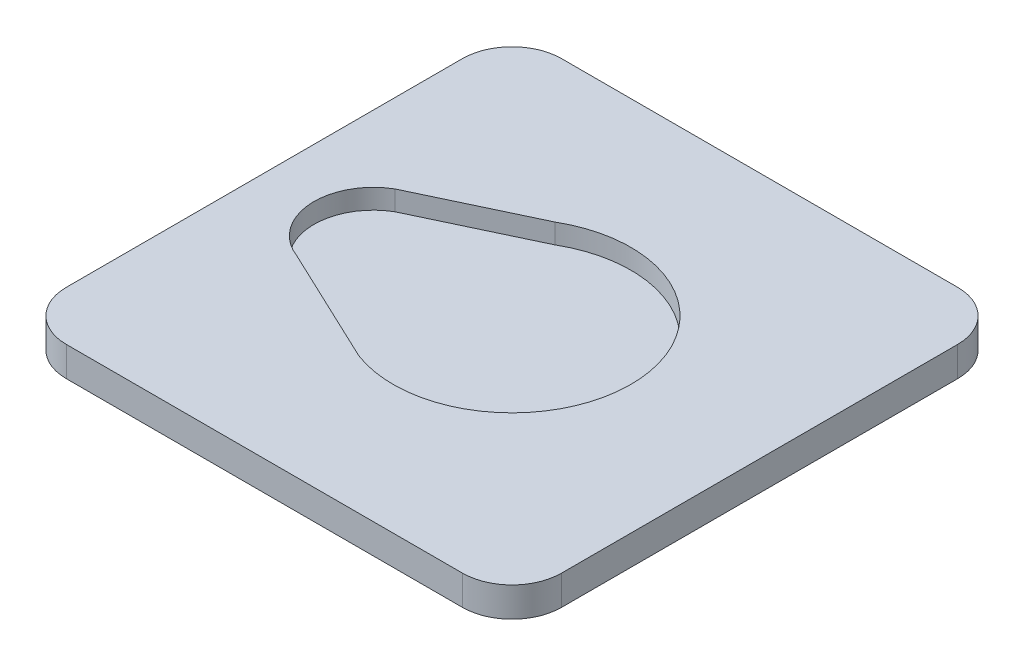
from build123d import *

# Parameters (mm, degrees)
BOSS_EXTRUDE1_DEPTH = 15
BOSS_EXTRUDE2_DEPTH = 5
SKETCH4_W           = 200
SKETCH4_H           = 200
CUT_EXTRUDE1_DEPTH  = 1


with BuildPart() as part:
    # Sketch1 → Boss-Extrude1 (new body)
    with BuildSketch(Plane(origin=(0, 0, 0), x_dir=(1, 0, 0), z_dir=(0, 1, 0))):
        with BuildLine():
            Line((-100, 125), (100, 125))
            ThreePointArc((100, 125), (117.67766953, 117.67766953), (125, 100))
            Line((125, 100), (125, -100))
            ThreePointArc((125, -100), (117.67766953, -117.67766953), (100, -125))
            Line((100, -125), (-100, -125))
            ThreePointArc((-100, -125), (-117.67766953, -117.67766953), (-125, -100))
            Line((-125, -100), (-125, 100))
            ThreePointArc((-125, 100), (-117.67766953, 117.67766953), (-100, 125))
        make_face()
        with BuildLine():
            Line((-30.080566992, 51.914925498), (-85.040283496, 25.957462749))
            ThreePointArc((-85.040283496, 25.957462749), (-99.898608517, -2.464388108), (-80.587095233, -28.069795413))
            Line((-80.587095233, -28.069795413), (-21.174190466, -56.139590826))
            ThreePointArc((-21.174190466, -56.139590826), (59.797217034, 4.928776216), (-30.080566992, 51.914925498))
        make_face(mode=Mode.SUBTRACT)
    extrude(amount=BOSS_EXTRUDE1_DEPTH)

    # Sketch2 → Boss-Extrude2 (add)
    with BuildSketch(Plane.XZ):
        with BuildLine():
            Line((100, 125), (-100, 125))
            ThreePointArc((-100, 125), (-117.67766953, 117.67766953), (-125, 100))
            Line((-125, 100), (-125, -100))
            ThreePointArc((-125, -100), (-117.67766953, -117.67766953), (-100, -125))
            Line((-100, -125), (100, -125))
            ThreePointArc((100, -125), (117.67766953, -117.67766953), (125, -100))
            Line((125, -100), (125, 100))
            ThreePointArc((125, 100), (117.67766953, 117.67766953), (100, 125))
        make_face()
    extrude(amount=-BOSS_EXTRUDE2_DEPTH)

    # Sketch4 → Cut-Extrude1 (cut)
    with BuildSketch(Plane.XZ):
        Rectangle(SKETCH4_W, SKETCH4_H)
    extrude(amount=-CUT_EXTRUDE1_DEPTH, mode=Mode.SUBTRACT)


solid = part.part
